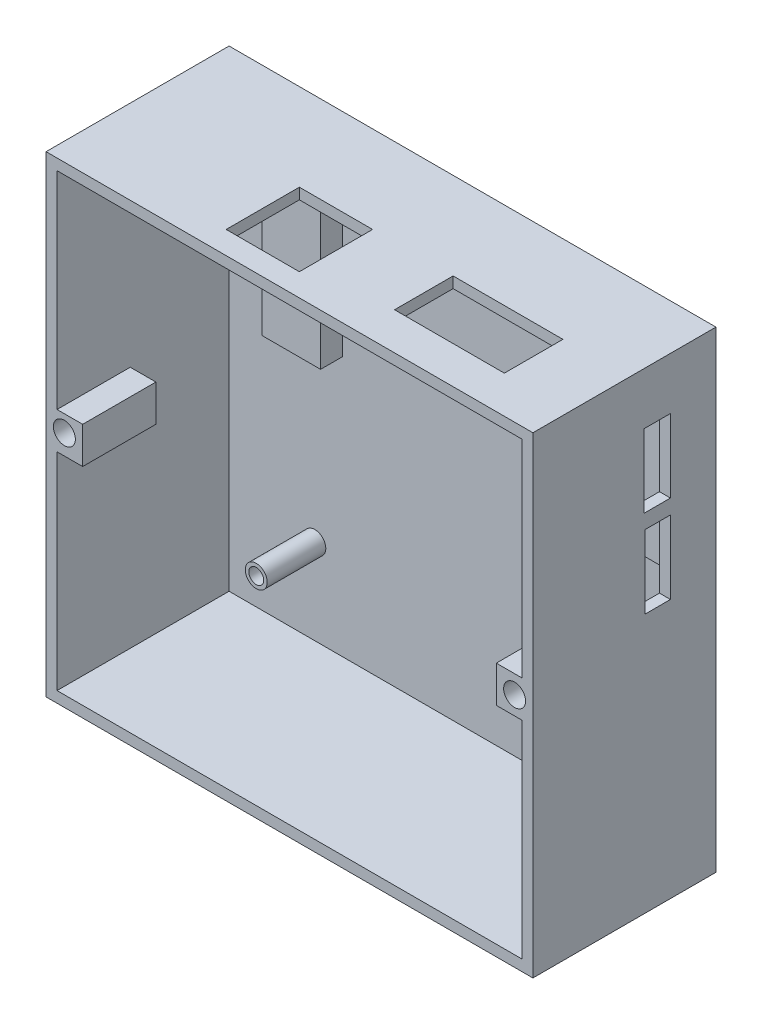
from build123d import *

# Parameters (mm, degrees)
SKETCH1_W            = 66.5
SKETCH1_H            = 64.5
BOSS_EXTRUDE1_DEPTH  = 25
SKETCH2_W            = 63.5
SKETCH2_H            = 61.5
CUT_EXTRUDE2_DEPTH   = 23.5
SKETCH9_W            = 10
SKETCH9_H            = 5
BOSS_EXTRUDE5_DEPTH  = 5
SKETCH14_R           = 1.5
CUT_EXTRUDE4_DEPTH   = 9
SKETCH17_W           = 10
SKETCH17_H           = 2.5
BOSS_EXTRUDE7_DEPTH  = 5
SKETCH18_R           = 1.5
CUT_EXTRUDE6_DEPTH   = 9
SKETCH19_R           = 1.5
BOSS_EXTRUDE9_DEPTH  = 8
SKETCH22_R           = 1.015
CUT_EXTRUDE7_DEPTH   = 7.5
SKETCH23_W           = 56
SKETCH23_H           = 20
BOSS_EXTRUDE12_DEPTH = 3
SKETCH26_W           = 42
SKETCH26_H           = 20
CUT_EXTRUDE9_DEPTH   = 3
CUT_EXTRUDE12_DEPTH  = 3
CUT_EXTRUDE13_DEPTH  = 3
SKETCH51_W           = 15
SKETCH51_H           = 8
CUT_EXTRUDE14_DEPTH  = 1.5


with BuildPart() as part:
    # Sketch1 → Boss-Extrude1 (new body)
    with BuildSketch(Plane.XY):
        Rectangle(SKETCH1_W, SKETCH1_H)
    extrude(amount=BOSS_EXTRUDE1_DEPTH)

    # Sketch2 → Cut-Extrude2 (cut)
    with BuildSketch(Plane.XY.offset(25)):
        Rectangle(SKETCH2_W, SKETCH2_H)
    extrude(amount=-CUT_EXTRUDE2_DEPTH, mode=Mode.SUBTRACT)

    # Sketch9 → Boss-Extrude5 (add)
    with BuildSketch(Plane.ZY.offset(33.25)):
        with Locations((20, 0)):
            Rectangle(SKETCH9_W, SKETCH9_H)
    extrude(amount=-BOSS_EXTRUDE5_DEPTH)

    # Sketch14 → Cut-Extrude4 (cut)
    with BuildSketch(Plane.XY.offset(25)):
        with Locations((-30.75, 0.228198866)):
            Circle(SKETCH14_R)
    extrude(amount=-CUT_EXTRUDE4_DEPTH, mode=Mode.SUBTRACT)

    # Sketch17 → Boss-Extrude7 (add)
    with BuildSketch(Plane(origin=(33.25, 0, 0), x_dir=(0, 0, -1), z_dir=(1, 0, 0))):
        with Locations((-20, 1.25)):
            Rectangle(SKETCH17_W, SKETCH17_H)
        with Locations((-20, -1.25)):
            Rectangle(SKETCH17_W, SKETCH17_H)
    extrude(amount=-BOSS_EXTRUDE7_DEPTH)

    # Sketch18 → Cut-Extrude6 (cut)
    with BuildSketch(Plane.XY.offset(25)):
        with Locations((30.75, 0)):
            Circle(SKETCH18_R)
    extrude(amount=-CUT_EXTRUDE6_DEPTH, mode=Mode.SUBTRACT)

    # Sketch19 → Boss-Extrude9 (add)
    with BuildSketch(Plane.XY.offset(1.5)):
        with Locations((-20.04, 29.09)):
            Circle(SKETCH19_R)
        with Locations(Location((30.04, 29.09, 0), (0, 0, 180))):
            Circle(SKETCH19_R)
        with Locations(Location((-20.04, -19.09, 0), (0, 0, 180))):
            Circle(SKETCH19_R)
        with Locations((30.04, -18.96)):
            Circle(SKETCH19_R)
    extrude(amount=BOSS_EXTRUDE9_DEPTH)

    # Sketch22 → Cut-Extrude7 (cut)
    with BuildSketch(Plane.XY.offset(9.5)):
        with Locations((-20.04, 29.09)):
            Circle(SKETCH22_R)
        with Locations((30.04, 29.049098521)):
            Circle(SKETCH22_R)
        with Locations((30.04, -18.96)):
            Circle(SKETCH22_R)
        with Locations((-20.04, -19.09)):
            Circle(SKETCH22_R)
    extrude(amount=-CUT_EXTRUDE7_DEPTH, mode=Mode.SUBTRACT)

    # Sketch23 → Boss-Extrude12 (add)
    with BuildSketch(Plane.XY.offset(1.5)):
        with Locations((3.75, 14.75)):
            Rectangle(SKETCH23_W, SKETCH23_H)
    extrude(amount=BOSS_EXTRUDE12_DEPTH)

    # Sketch26 → Cut-Extrude9 (cut)
    with BuildSketch(Plane.XY.offset(4.5)):
        with Locations((4.75, 14.75)):
            Rectangle(SKETCH26_W, SKETCH26_H)
    extrude(amount=-CUT_EXTRUDE9_DEPTH, mode=Mode.SUBTRACT)

    # Sketch45 → Cut-Extrude12 (cut)
    with BuildSketch(Plane(origin=(33.25, 0, 0), x_dir=(0, 0, -1), z_dir=(1, 0, 0))):
        Polygon((-9.814807173, 15.135540206), (-6.214807173, 15.135540206), (-6.214807173, 24.735863123), (-6.214807173, 25.135540206), (-9.814807173, 25.135540206), align=None)
        Polygon((-6.214807173, 4.436476389), (-6.214807173, 13.135540206), (-9.714807173, 13.135540206), (-9.714807173, 3.135540206), (-6.214807173, 3.135540206), align=None)
    extrude(amount=-CUT_EXTRUDE12_DEPTH, mode=Mode.SUBTRACT)

    # Sketch46 → Cut-Extrude13 (cut)
    with BuildSketch(Plane(origin=(0, 32.25, 0), x_dir=(1, 0, 0), z_dir=(0, 1, 0))):
        Polygon((-11.263140916, -11.9), (-11.75, -11.9), (-11.75, -21.9), (-1.75, -21.9), (-1.75, -11.9), align=None)
    extrude(amount=-CUT_EXTRUDE13_DEPTH, mode=Mode.SUBTRACT)

    # Sketch51 → Cut-Extrude14 (cut)
    with BuildSketch(Plane(origin=(0, 32.25, 0), x_dir=(1, 0, 0), z_dir=(0, 1, 0))):
        with Locations((16.75, -15.9)):
            Rectangle(SKETCH51_W, SKETCH51_H)
    extrude(amount=-CUT_EXTRUDE14_DEPTH, mode=Mode.SUBTRACT)


solid = part.part
